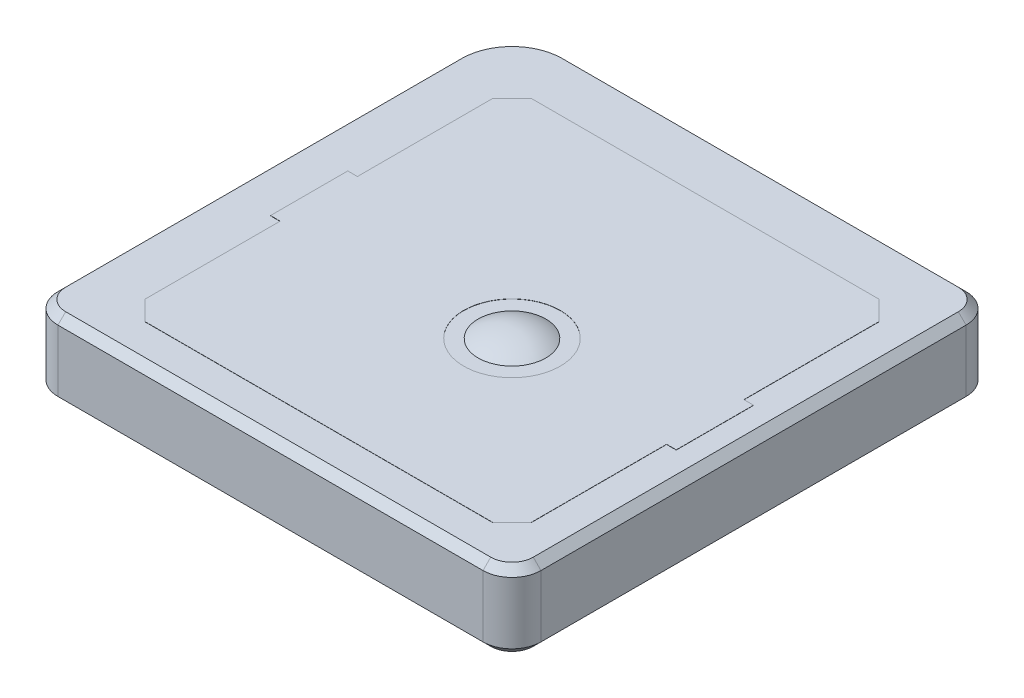
from build123d import *

# Parameters (mm, degrees)
BOSS_EXTRUDE1_DEPTH = 4
CHAMFER1_SIZE       = 0.4
BOSS_EXTRUDE2_START = 4
SKETCH3_R           = 2.5
BOSS_EXTRUDE2_DEPTH = 0.01


with BuildPart() as part:
    # Sketch1 → Boss-Extrude1 (new body)
    with BuildSketch(Plane(origin=(0, 0, 0), x_dir=(1, 0, 0), z_dir=(0, 1, 0))):
        with BuildLine():
            Line((-12.75, -10.75), (9.25, -10.75))
            ThreePointArc((9.25, -10.75), (10.310660172, -10.310660172), (10.75, -9.25))
            Line((10.75, -9.25), (10.75, 12.75))
            ThreePointArc((10.75, 12.75), (10.310660172, 13.810660172), (9.25, 14.25))
            Line((9.25, 14.25), (-11.25, 14.25))
            ThreePointArc((-11.25, 14.25), (-13.371320344, 13.371320344), (-14.25, 11.25))
            Line((-14.25, 11.25), (-14.25, -9.25))
            ThreePointArc((-14.25, -9.25), (-13.810660172, -10.310660172), (-12.75, -10.75))
        make_face()
    extrude(amount=BOSS_EXTRUDE1_DEPTH)

    # Chamfer1
    chamfer1_edges = [part.edges().sort_by_distance(p)[0] for p in [
        (-13.810660172, 4, 10.310660172),
        (-14.25, 0, -1),
        (-13.371320344, 0, -13.371320344),
        (-1.75, 4, 10.75),
        (10.310660172, 4, 10.310660172),
        (10.75, 4, -1.75),
        (10.310660172, 4, -13.810660172),
        (-1, 4, -14.25),
        (-13.371320344, 4, -13.371320344),
        (-14.25, 4, -1),
        (-1, 0, -14.25),
        (10.310660172, 0, -13.810660172),
        (10.75, 0, -1.75),
        (10.310660172, 0, 10.310660172),
        (-1.75, 0, 10.75),
        (-13.810660172, 0, 10.310660172),
    ]]
    chamfer(chamfer1_edges, length=CHAMFER1_SIZE)

    # Sketch2 → Revolve1 (revolve)
    with BuildSketch(Plane.XY, mode=Mode.PRIVATE) as revolve1_sk:
        with BuildLine():
            Line((-3.215339078, 1.983898683), (-0.5, 1.983898683))
            Line((-0.5, 1.983898683), (-0.5, -2.4))
            Line((-0.5, -2.4), (0, -2.4))
            Line((0, -2.4), (0, 4.5))
            ThreePointArc((0, 4.5), (-2.041394819, 3.796209153), (-3.215339078, 1.983898683))
        make_face()
    revolve(revolve1_sk.sketch.rotate(Axis((0, 5.892068095, 0), (0, -1, 0)), 270), axis=Axis((0, 5.892068095, 0), (0, -1, 0)))

    # Sketch3 → Boss-Extrude2 (add)
    with BuildSketch(Plane(origin=(0, 0, 0), x_dir=(1, 0, 0), z_dir=(0, 1, 0)).offset(BOSS_EXTRUDE2_START)):
        Polygon((-10.25, 11.25), (7.75, 11.25), (8.75, 10.25), (8.75, 3.25), (9.25, 3.25), (9.25, -0.75), (8.75, -0.75), (8.75, -7.75), (7.75, -8.75), (-10.25, -8.75), (-11.25, -7.75), (-11.25, -0.75), (-11.75, -0.75), (-11.75, 3.25), (-11.25, 3.25), (-11.25, 10.25), align=None)
        with Locations(Location((0, 0, 0), (0, 0, 90))):
            Circle(SKETCH3_R, mode=Mode.SUBTRACT)
    extrude(amount=BOSS_EXTRUDE2_DEPTH)


solid = part.part
